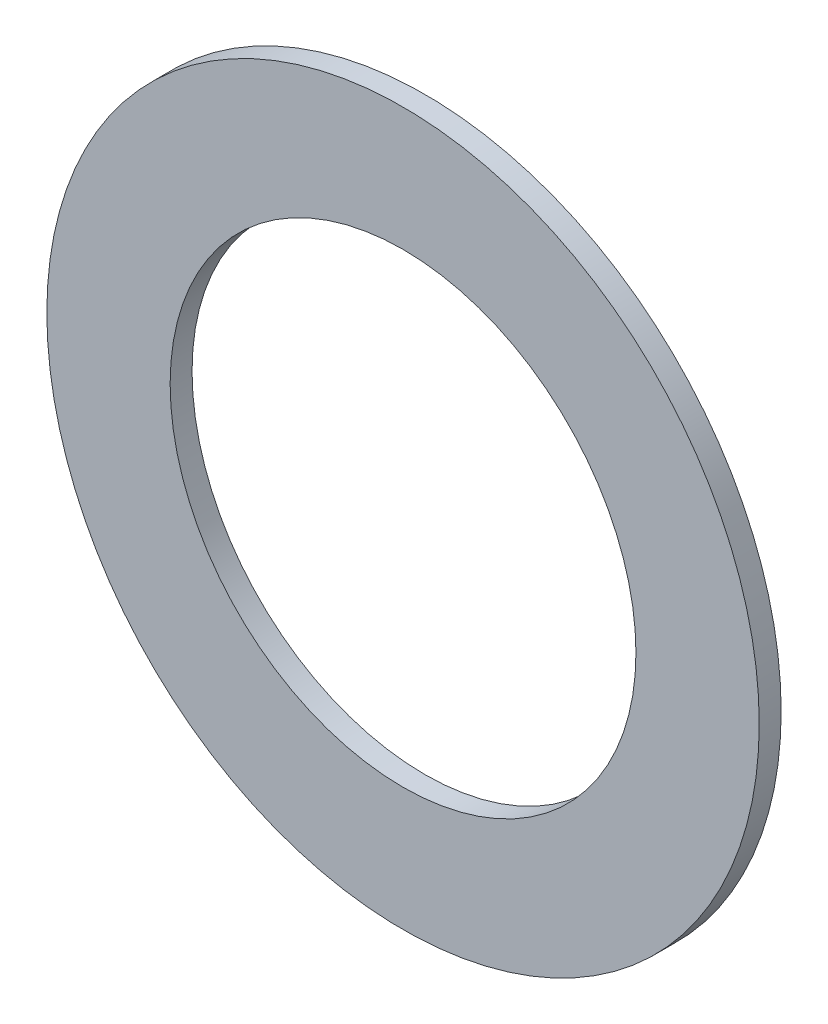
from build123d import *

# Parameters (mm, degrees)
SKETCH1_R           = 32.5
SKETCH1_R_2         = 21.25
BOSS_EXTRUDE1_DEPTH = 2


with BuildPart() as part:
    # Sketch1 → Boss-Extrude1 (new body)
    with BuildSketch(Plane.XY):
        Circle(SKETCH1_R)
        Circle(SKETCH1_R_2, mode=Mode.SUBTRACT)
    extrude(amount=BOSS_EXTRUDE1_DEPTH)


solid = part.part
